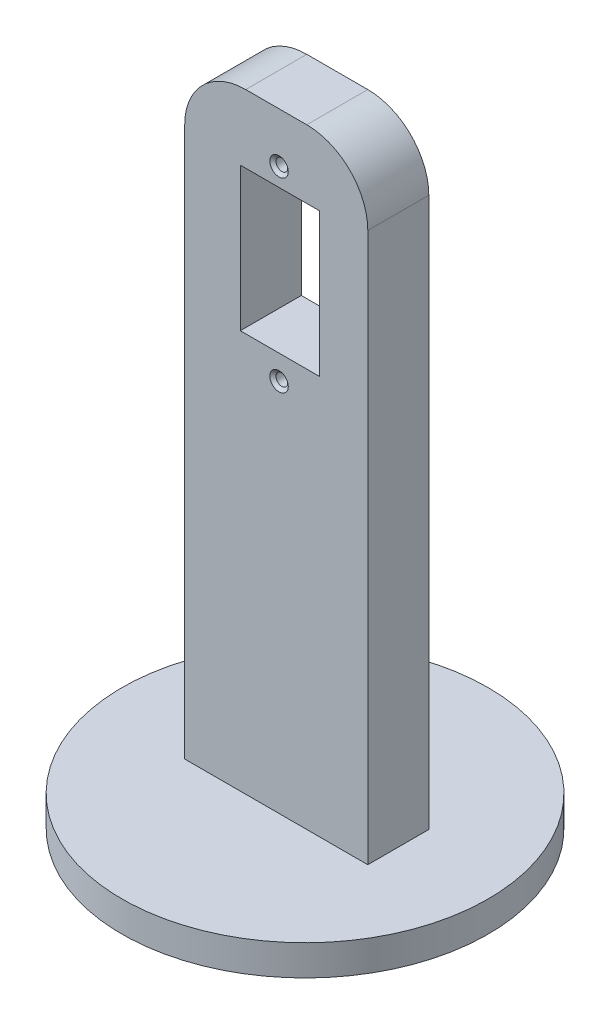
from build123d import *

# Parameters (mm, degrees)
BOSS_EXTRUDE1_DEPTH                               = 10
SKETCH6_W                                         = 13
SKETCH6_H                                         = 23.5
CUT_EXTRUDE1_DEPTH                                = 101.559411442
CSK_FOR_0_FLAT_HEAD_MACHINE_SCREW_100_D           = 1.9304
CSK_FOR_0_FLAT_HEAD_MACHINE_SCREW_100_CSINK_D     = 3.0226
CSK_FOR_0_FLAT_HEAD_MACHINE_SCREW_100_CSINK_ANGLE = 100
SKETCH15_R                                        = 30
BOSS_EXTRUDE2_DEPTH                               = 5


with BuildPart() as part:
    # Sketch4 → Boss-Extrude1 (new body)
    with BuildSketch(Plane.XY):
        with BuildLine():
            Line((39.677308084, 80.316960409), (49.677308084, 80.316960409))
            ThreePointArc((49.677308084, 80.316960409), (56.748375896, 77.388028221), (59.677308084, 70.316960409))
            Line((59.677308084, 70.316960409), (59.677308084, -19.683039591))
            Line((59.677308084, -19.683039591), (29.677308084, -19.683039591))
            Line((29.677308084, -19.683039591), (29.677308084, 70.316960409))
            ThreePointArc((29.677308084, 70.316960409), (32.606240272, 77.388028221), (39.677308084, 80.316960409))
        make_face()
    extrude(amount=BOSS_EXTRUDE1_DEPTH)

    # Sketch6 → Cut-Extrude1 (cut, through all)
    with BuildSketch(Plane.XY.offset(10)):
        with Locations((45.288344904, 57.398882655)):
            Rectangle(SKETCH6_W, SKETCH6_H)
    extrude(amount=-CUT_EXTRUDE1_DEPTH, mode=Mode.SUBTRACT)

    # CSK for #0 Flat Head Machine Screw (100)2 (through all)
    with Locations(Plane.XY.offset(10)):
        with Locations((45.136449354, 72.148882655), (45.136449354, 41.648882655)):
            CounterSinkHole(CSK_FOR_0_FLAT_HEAD_MACHINE_SCREW_100_D / 2, CSK_FOR_0_FLAT_HEAD_MACHINE_SCREW_100_CSINK_D / 2, counter_sink_angle=CSK_FOR_0_FLAT_HEAD_MACHINE_SCREW_100_CSINK_ANGLE)

    # Sketch15 → Boss-Extrude2 (add)
    with BuildSketch(Plane.XZ.offset(19.683039591)):
        with Locations(Location((44.398165665, 5, 0), (0, 0, 270))):
            Circle(SKETCH15_R)
    extrude(amount=BOSS_EXTRUDE2_DEPTH)


solid = part.part
